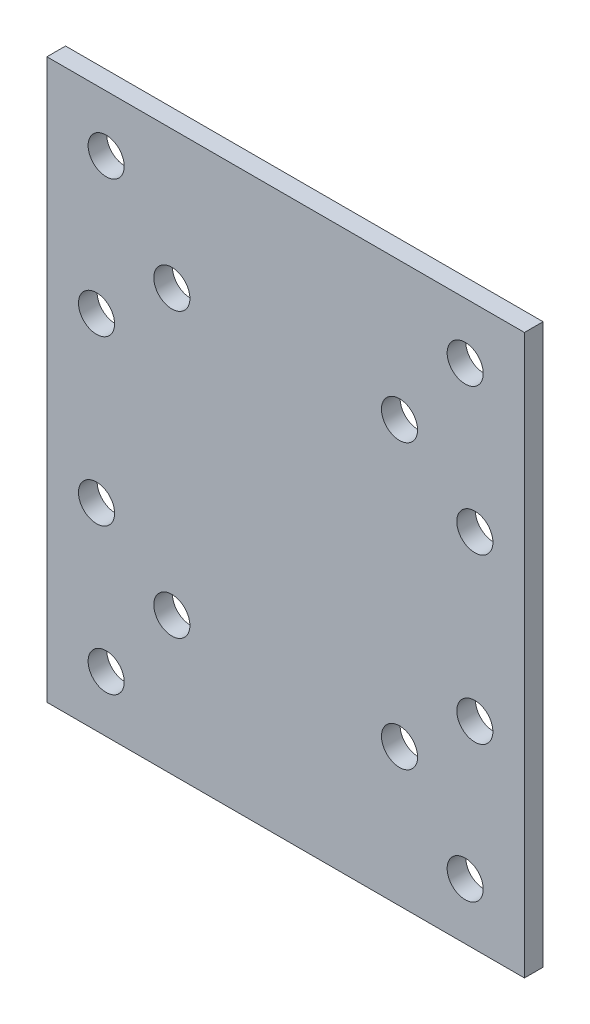
from build123d import *

# Parameters (mm, degrees)
SKETCH1_W      = 410
SKETCH1_H      = 480
SKETCH1_R      = 15.5
EXTRUDE1_DEPTH = 16


with BuildPart() as part:
    # Sketch1 → Extrude1 (new body)
    with BuildSketch(Plane.XY):
        with Locations((205, 240)):
            Rectangle(SKETCH1_W, SKETCH1_H)
        with Locations((367.4021887, 310.38841599)):
            Circle(SKETCH1_R, mode=Mode.SUBTRACT)
        with Locations((107.261778202, 118.413652083)):
            Circle(SKETCH1_R, mode=Mode.SUBTRACT)
        with Locations((50.874342549, 48.267682131)):
            Circle(SKETCH1_R, mode=Mode.SUBTRACT)
        with Locations(Location((42.5978113, 310.38841599, 0), (0, 0, 180))):
            Circle(SKETCH1_R, mode=Mode.SUBTRACT)
        with Locations(Location((359.125657451, 48.267682131, 0), (0, 0, 180))):
            Circle(SKETCH1_R, mode=Mode.SUBTRACT)
        with Locations(Location((302.738221798, 118.413652083, 0), (0, 0, 180))):
            Circle(SKETCH1_R, mode=Mode.SUBTRACT)
        with Locations(Location((367.4021887, 169.61158401, 0), (0, 0, 180))):
            Circle(SKETCH1_R, mode=Mode.SUBTRACT)
        with Locations(Location((50.874342549, 431.732317869, 0), (0, 0, 180))):
            Circle(SKETCH1_R, mode=Mode.SUBTRACT)
        with Locations(Location((107.261778202, 361.586347917, 0), (0, 0, 180))):
            Circle(SKETCH1_R, mode=Mode.SUBTRACT)
        with Locations((42.5978113, 169.61158401)):
            Circle(SKETCH1_R, mode=Mode.SUBTRACT)
        with Locations((302.738221798, 361.586347917)):
            Circle(SKETCH1_R, mode=Mode.SUBTRACT)
        with Locations((359.125657451, 431.732317869)):
            Circle(SKETCH1_R, mode=Mode.SUBTRACT)
    extrude(amount=EXTRUDE1_DEPTH)


solid = part.part
